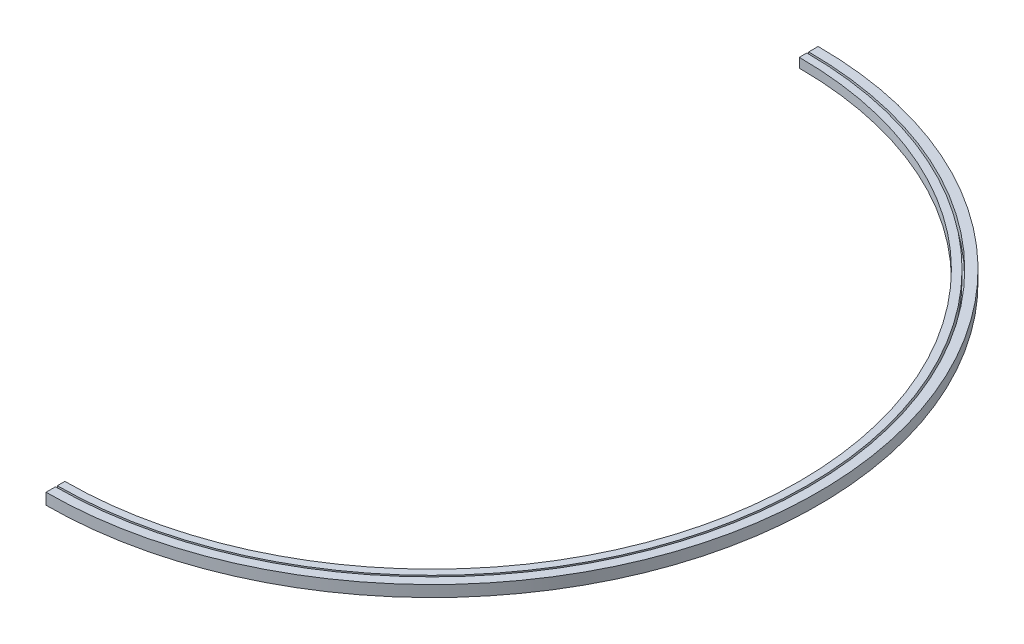
from build123d import *

# Parameters (mm, degrees)
BOSS_EXTRUDE1_DEPTH   = 100
BOSS_EXTRUDE1_2_DEPTH = 100
BOSS_EXTRUDE2_START   = 20
BOSS_EXTRUDE2_DEPTH   = 20


with BuildPart() as part:
    # Sketch1 → Boss-Extrude1 (new body)
    with BuildSketch(Plane(origin=(0, 0, 0), x_dir=(1, 0, 0), z_dir=(0, 1, 0))):
        with BuildLine():
            ThreePointArc((4100, 0), (2899.137802865, 2899.137802865), (0, 4100))
            Line((0, 4100), (0, 4000))
            ThreePointArc((0, 4000), (2828.427124746, 2828.427124746), (4000, 0))
            ThreePointArc((4000, 0), (2828.427124746, -2828.427124746), (0, -4000))
            Line((0, -4000), (0, -4100))
            ThreePointArc((0, -4100), (2899.137802865, -2899.137802865), (4100, 0))
        make_face()
    extrude(amount=BOSS_EXTRUDE1_DEPTH)

    # Sketch2 → Boss-Extrude2 (add)
    with BuildSketch(Plane.XZ.offset(BOSS_EXTRUDE2_START)):
        with BuildLine():
            ThreePointArc((4100, 0), (2899.137802865, 2899.137802865), (0, 4100))
            Line((0, 4100), (0, 3980))
            ThreePointArc((0, 3980), (3980, 0), (0, -3980))
            Line((0, -3980), (0, -4100))
            ThreePointArc((0, -4100), (2899.137802865, -2899.137802865), (4100, 0))
        make_face()
    extrude(amount=-BOSS_EXTRUDE2_DEPTH)


with BuildPart() as body_2:
    # Sketch1 → Boss-Extrude1 2 (new body)
    with BuildSketch(Plane(origin=(0, 0, 0), x_dir=(1, 0, 0), z_dir=(0, 1, 0))):
        with BuildLine():
            ThreePointArc((3980, 0), (2814.284989123, 2814.284989122), (0, 3980))
            Line((0, 3980), (0, 3900))
            ThreePointArc((0, 3900), (2757.716446628, 2757.716446627), (3900, 0))
            ThreePointArc((3900, 0), (2757.716446628, -2757.716446627), (0, -3900))
            Line((0, -3900), (0, -3980))
            ThreePointArc((0, -3980), (2814.284989123, -2814.284989122), (3980, 0))
        make_face()
    extrude(amount=BOSS_EXTRUDE1_2_DEPTH)


solid = Compound([part.part, body_2.part])
